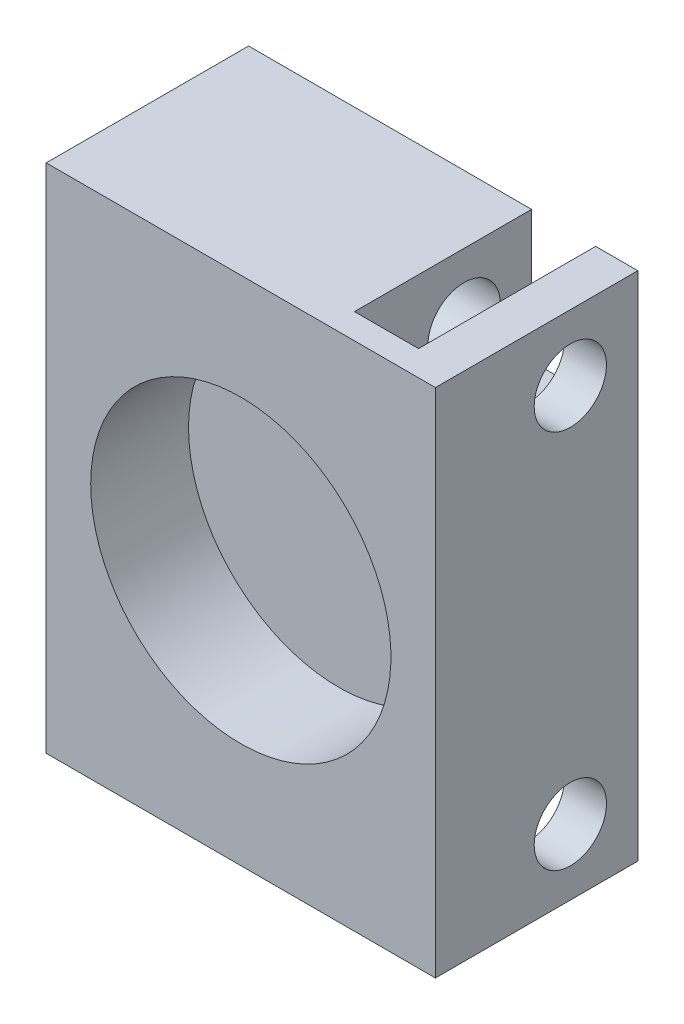
from build123d import *

# Parameters (mm, degrees)
SKETCH1_W           = 29.306429484
SKETCH1_H           = 38.503943882
SKETCH1_R           = 11.303
BOSS_EXTRUDE1_DEPTH = 15.24
SKETCH4_W           = 4.826
SKETCH4_H           = 9.906
CUT_EXTRUDE1_DEPTH  = 13.335
SKETCH5_R           = 11.303
BOSS_EXTRUDE3_DEPTH = 7.874
SKETCH6_R           = 2.721770122
CUT_EXTRUDE2_DEPTH  = 31.75


with BuildPart() as part:
    # Sketch1 → Boss-Extrude1 (new body)
    with BuildSketch(Plane.XY):
        Rectangle(SKETCH1_W, SKETCH1_H)
        with Locations(Location((0, 0, 0), (0, 0, 180))):
            Circle(SKETCH1_R, mode=Mode.SUBTRACT)
    extrude(amount=BOSS_EXTRUDE1_DEPTH)

    # Sketch4 → Cut-Extrude1 (cut)
    with BuildSketch(Plane(origin=(0, 0, 0), x_dir=(-1, 0, 0), z_dir=(0, 0, -1))):
        with Locations((-9.065214742, 14.298971941)):
            Rectangle(SKETCH4_W, SKETCH4_H)
    cut_extrude1 = extrude(amount=-CUT_EXTRUDE1_DEPTH, mode=Mode.SUBTRACT)

    # Sketch5 → Boss-Extrude3 (add)
    with BuildSketch(Plane(origin=(0, 0, 0), x_dir=(-1, 0, 0), z_dir=(0, 0, -1))):
        Circle(SKETCH5_R)
    extrude(amount=-BOSS_EXTRUDE3_DEPTH)

    # Sketch6 → Cut-Extrude2 (cut)
    with BuildSketch(Plane.ZY.offset(14.653214742)):
        with Locations((5.08, 14.298971941)):
            Circle(SKETCH6_R)
    cut_extrude2 = extrude(amount=-CUT_EXTRUDE2_DEPTH, mode=Mode.SUBTRACT)

    # Mirror1: Cut-Extrude1, Cut-Extrude2 across plane
    add(cut_extrude1.mirror(Plane.ZX), mode=Mode.SUBTRACT)
    add(cut_extrude2.mirror(Plane.ZX), mode=Mode.SUBTRACT)


solid = part.part
